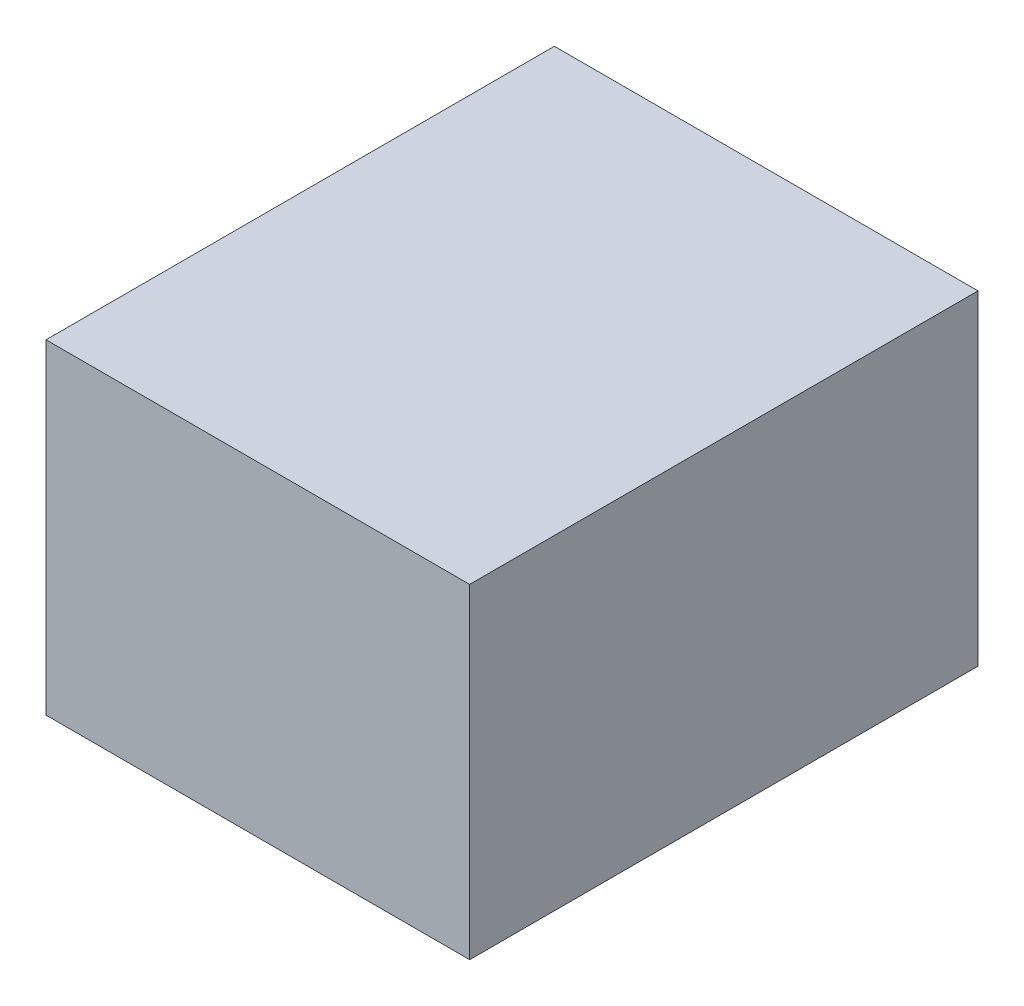
from build123d import *

# Parameters (mm, degrees)
SKETCH1_W           = 139.7
SKETCH1_H           = 167.64
BOSS_EXTRUDE1_DEPTH = 107.188


with BuildPart() as part:
    # Sketch1 → Boss-Extrude1 (new body)
    with BuildSketch(Plane(origin=(0, 0, 0), x_dir=(1, 0, 0), z_dir=(0, 1, 0))):
        with Locations((69.85, 83.82)):
            Rectangle(SKETCH1_W, SKETCH1_H)
    extrude(amount=BOSS_EXTRUDE1_DEPTH)


solid = part.part
